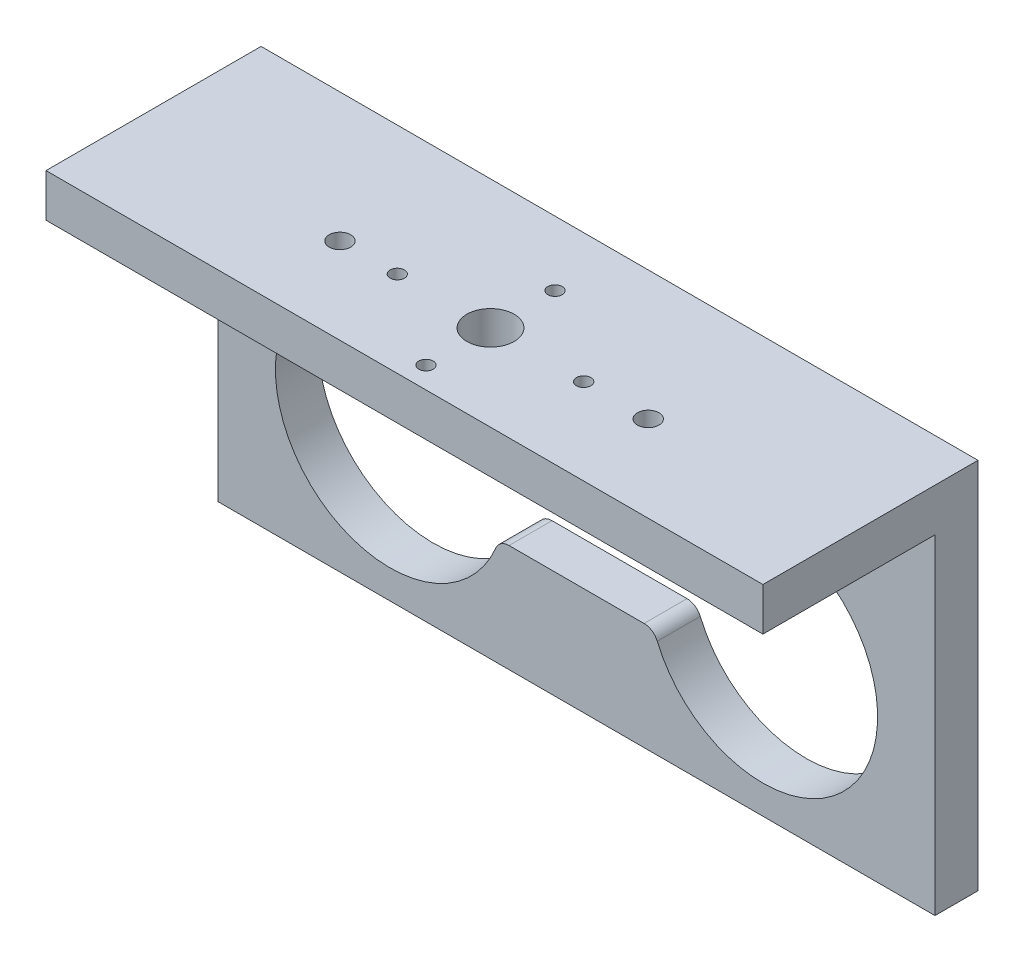
from build123d import *

# Parameters (mm, degrees)
SKETCH_1_W          = 50
SKETCH_1_H          = 20
EXTRUDE_1_DEPTH     = 3
SKETCH_2_W          = 50
SKETCH_2_H          = 15
EXTRUDE_2_DEPTH     = 6
SKETCH_5_W          = 50
SKETCH_5_H          = 12
CUT_EXTRUDE_2_DEPTH = 3
SKETCH_4_R          = 1.65
SKETCH_4_R_2        = 0.5
SKETCH_4_R_3        = 0.75
CUT_EXTRUDE_1_DEPTH = 3


with BuildPart() as part:
    # 草图1 → 凸台-拉伸1 (new body)
    with BuildSketch(Plane.XY):
        Rectangle(SKETCH_1_W, SKETCH_1_H)
        with BuildLine():
            Line((-4.708438024, 2.5), (4.708438024, 2.5))
            ThreePointArc((4.708438024, 2.5), (5.261208823, 2.666666667), (5.629722688, 3.111111111))
            ThreePointArc((5.629722688, 3.111111111), (21, 0), (5.629722688, -3.111111111))
            ThreePointArc((5.629722688, -3.111111111), (5.261208823, -2.666666667), (4.708438024, -2.5))
            Line((4.708438024, -2.5), (-4.708438024, -2.5))
            ThreePointArc((-4.708438024, -2.5), (-5.261208823, -2.666666667), (-5.629722688, -3.111111111))
            ThreePointArc((-5.629722688, -3.111111111), (-21, 0), (-5.629722688, 3.111111111))
            ThreePointArc((-5.629722688, 3.111111111), (-5.261208823, 2.666666667), (-4.708438024, 2.5))
        make_face(mode=Mode.SUBTRACT)
        with BuildLine():
            Line((3.25, 5.5), (-3.25, 5.5))
            ThreePointArc((-3.25, 5.5), (-5, 7.25), (-3.25, 9))
            Line((-3.25, 9), (3.25, 9))
            ThreePointArc((3.25, 9), (5, 7.25), (3.25, 5.5))
        make_face(mode=Mode.SUBTRACT)
    extrude(amount=EXTRUDE_1_DEPTH)

    # 草图2 → 凸台-拉伸2 (add)
    with BuildSketch(Plane(origin=(0, 10, 0), x_dir=(1, 0, 0), z_dir=(0, 1, 0))):
        with Locations((0, -7.5)):
            Rectangle(SKETCH_2_W, SKETCH_2_H)
    extrude(amount=EXTRUDE_2_DEPTH)

    # 草图5 → 切除-拉伸2 (cut)
    with BuildSketch(Plane.XZ.offset(-10)):
        with Locations((0, 9)):
            Rectangle(SKETCH_5_W, SKETCH_5_H)
    extrude(amount=-CUT_EXTRUDE_2_DEPTH, mode=Mode.SUBTRACT)

    # 草图4 → 切除-拉伸1 (cut)
    with BuildSketch(Plane(origin=(0, 16, 0), x_dir=(1, 0, 0), z_dir=(0, 1, 0))):
        with Locations(Location((0, -9, 0), (0, 0, 180))):
            Circle(SKETCH_4_R)
        with Locations(Location((6.5, -9, 0), (0, 0, 180))):
            Circle(SKETCH_4_R_2)
        with Locations(Location((-6.5, -9, 0), (0, 0, 180))):
            Circle(SKETCH_4_R_2)
        with Locations(Location((11, -9, 0), (0, 0, 180))):
            Circle(SKETCH_4_R_3)
        with Locations(Location((-10.5, -9, 0), (0, 0, 180))):
            Circle(SKETCH_4_R_3)
        with Locations(Location((0, -4.5, 0), (0, 0, 180))):
            Circle(SKETCH_4_R_2)
        with Locations(Location((0, -13.5, 0), (0, 0, 180))):
            Circle(SKETCH_4_R_2)
    extrude(amount=-CUT_EXTRUDE_1_DEPTH, mode=Mode.SUBTRACT)


solid = part.part
